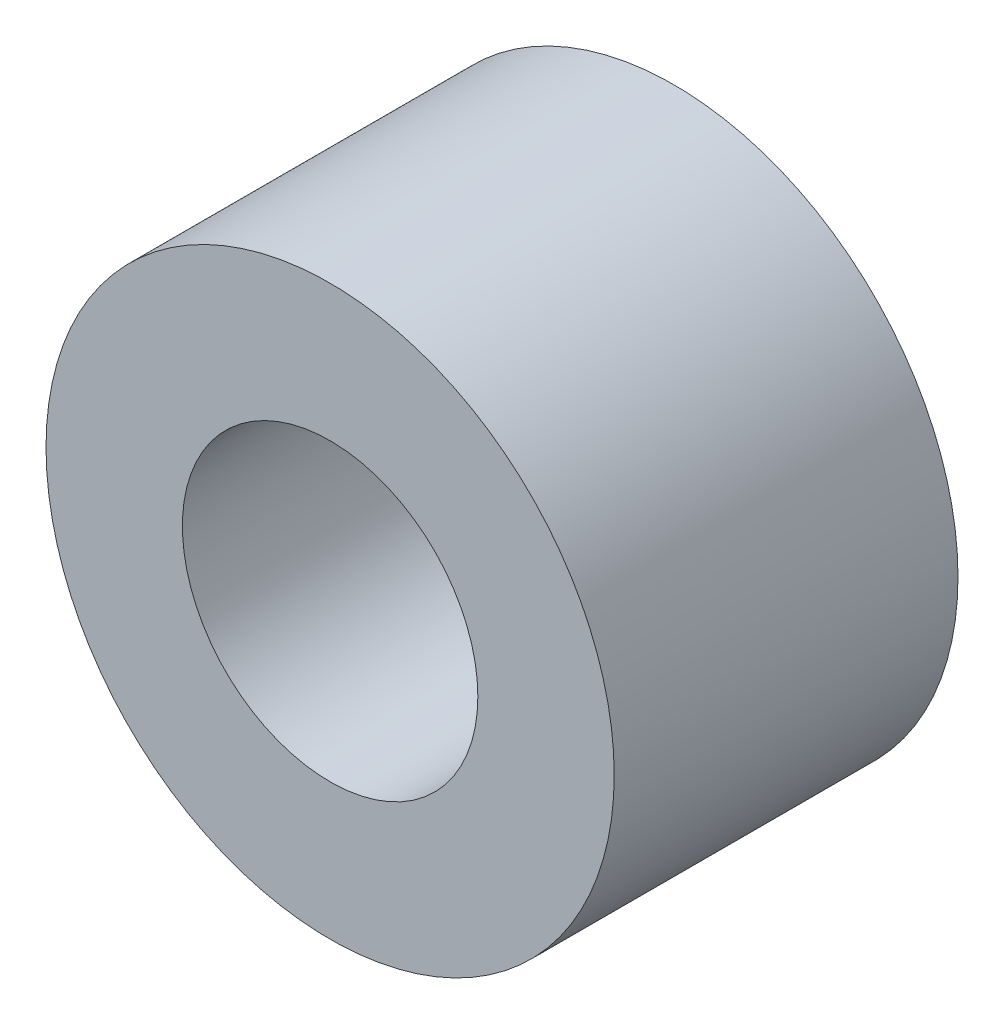
from build123d import *

# Parameters (mm, degrees)
SKETCH1_R           = 6.35
SKETCH1_R_2         = 3.302
BOSS_EXTRUDE1_DEPTH = 7.6835


with BuildPart() as part:
    # Sketch1 → Boss-Extrude1 (new body)
    with BuildSketch(Plane.XY):
        Circle(SKETCH1_R)
        Circle(SKETCH1_R_2, mode=Mode.SUBTRACT)
    extrude(amount=BOSS_EXTRUDE1_DEPTH)


solid = part.part
